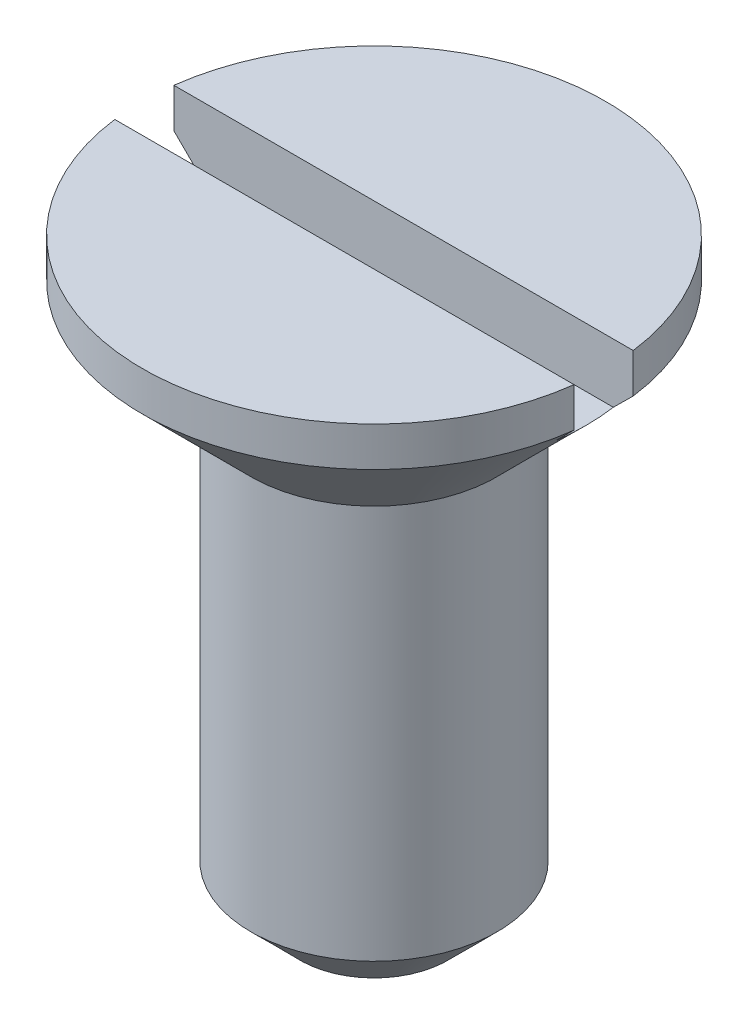
from build123d import *

# Parameters (mm, degrees)
SKETCH_13_W         = 4.7
SKETCH_13_H         = 0.6
CUT_EXTRUDE_9_DEPTH = 0.6
CHAMFER_1_SIZE      = 0.5


with BuildPart() as part:
    # Эскиз1 → Повернуть1 (revolve)
    with BuildSketch(Plane.XY):
        Polygon((0, 92.035042223), (0, 86.035042223), (1.25, 86.035042223), (1.25, 90.535042223), (2.35, 91.635042223), (2.35, 92.035042223), align=None)
    revolve(axis=Axis((0, 125.763182898, 0), (0, -1, 0)))

    # Эскиз13 → Вырез-Вытянуть9 (cut)
    with BuildSketch(Plane(origin=(0, 92.035042223, 0), x_dir=(-1, 0, 0), z_dir=(0, 1, 0))):
        Rectangle(SKETCH_13_W, SKETCH_13_H)
    extrude(amount=-CUT_EXTRUDE_9_DEPTH, mode=Mode.SUBTRACT)

    # Фаска1
    chamfer_1_edges = [part.edges().sort_by_distance(p)[0] for p in [
        (-1.25, 86.035042223, 0),
    ]]
    chamfer(chamfer_1_edges, length=CHAMFER_1_SIZE)


solid = part.part
